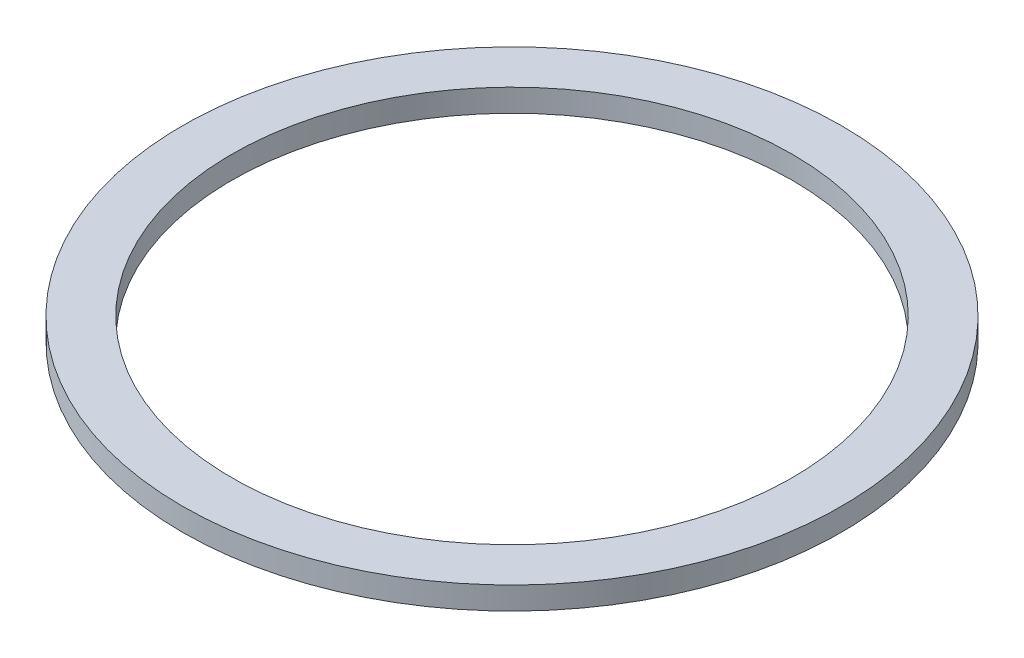
from build123d import *

# Parameters (mm, degrees)
SKETCH1_R           = 22.225
SKETCH1_R_2         = 18.8976
BOSS_EXTRUDE1_DEPTH = 1.524


with BuildPart() as part:
    # Sketch1 → Boss-Extrude1 (new body)
    with BuildSketch(Plane(origin=(0, 0, 0), x_dir=(1, 0, 0), z_dir=(0, 1, 0))):
        with Locations(Location((0, 0, 0), (0, 0, 90))):
            Circle(SKETCH1_R)
        with Locations(Location((0, 0, 0), (0, 0, 90))):
            Circle(SKETCH1_R_2, mode=Mode.SUBTRACT)
    extrude(amount=BOSS_EXTRUDE1_DEPTH)


solid = part.part
